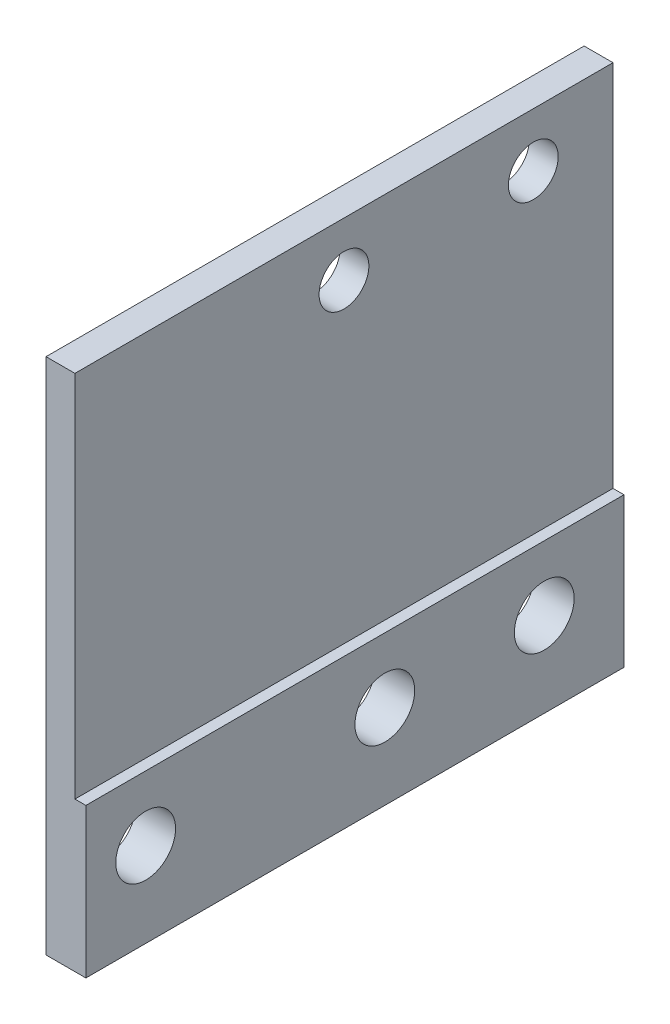
from build123d import *

# Parameters (mm, degrees)
BOSS_EXTRUDE1_DEPTH            = 22
BOSS_EXTRUDE1_DEPTH_BACK       = 5
TAP_DRILL_FOR_M3X0_5_TAP1_D    = 3
TAP_DRILL_FOR_M2_5X0_45_TAP1_D = 2.5


with BuildPart() as part:
    # Sketch1 → Boss-Extrude1 (new, two sides: drawn at the far end of the back side and taken through both)
    with BuildSketch(Plane.XY.offset(-BOSS_EXTRUDE1_DEPTH_BACK)):
        Polygon((0, 0), (2, 0), (2, 7.5), (1.45, 7.5), (1.45, 26), (0, 26), (0, 7.5), align=None)
    extrude(amount=BOSS_EXTRUDE1_DEPTH + BOSS_EXTRUDE1_DEPTH_BACK)

    # Tap Drill for M3x0.5 Tap1 (through all)
    with Locations(Plane(origin=(2, 0, 0), x_dir=(0, 0, -1), z_dir=(1, 0, 0))):
        with Locations((-7, 4.25), (-19, 4.25), (1, 4.25)):
            Hole(TAP_DRILL_FOR_M3X0_5_TAP1_D / 2)

    # Tap Drill for M2.5x0.45 Tap1 (through all)
    with Locations(Plane(origin=(1.45, 0, 0), x_dir=(0, 0, -1), z_dir=(1, 0, 0))):
        with Locations((1, 23.297203827), (-8.5, 23.297203827)):
            Hole(TAP_DRILL_FOR_M2_5X0_45_TAP1_D / 2)


solid = part.part
